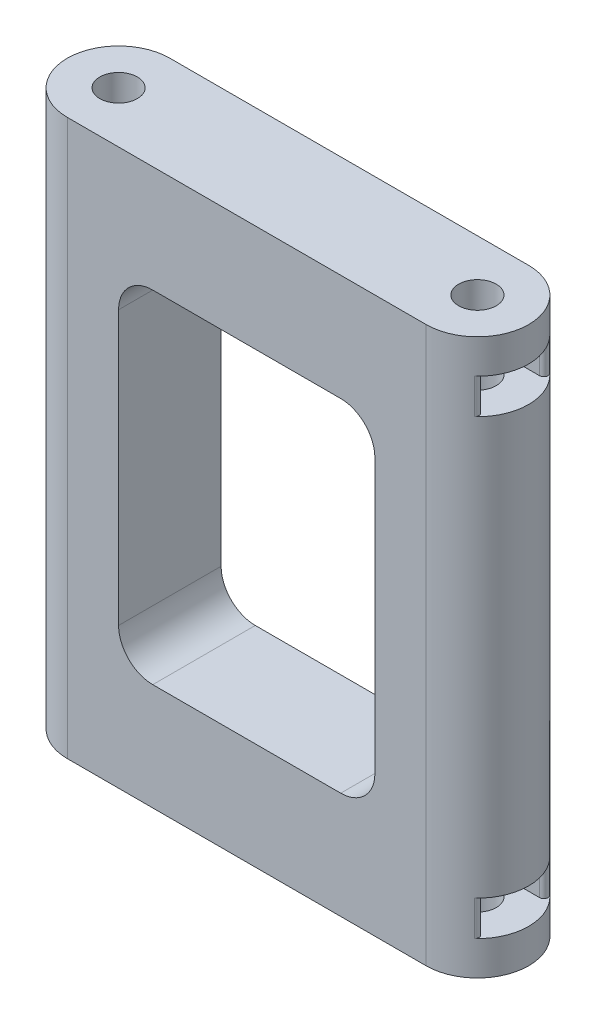
from build123d import *

# Parameters (mm, degrees)
SKETCH1_R            = 2.2
BOSS_EXTRUDE1_DEPTH  = 65
CUT_EXTRUDE1_DEPTH   = 4.1
FILLET1_R            = 0.5
FILLET1_OF_MIRROR1_R = 0.5
SKETCH4_W            = 30
SKETCH4_H            = 40
CUT_EXTRUDE2_DEPTH   = 82.688432474
FILLET2_R            = 4


with BuildPart() as part:
    # Sketch1 → Boss-Extrude1 (new body)
    with BuildSketch(Plane(origin=(0, 0, 0), x_dir=(1, 0, 0), z_dir=(0, 1, 0))):
        with BuildLine():
            Line((0, 6), (42, 6))
            ThreePointArc((42, 6), (48, 0), (42, -6))
            Line((42, -6), (0, -6))
            ThreePointArc((0, -6), (-6, 0), (0, 6))
        make_face()
        with Locations(Location((0, 0, 0), (0, 0, 270))):
            Circle(SKETCH1_R, mode=Mode.SUBTRACT)
        with Locations(Location((42, 0, 0), (0, 0, 270))):
            Circle(SKETCH1_R, mode=Mode.SUBTRACT)
    extrude(amount=BOSS_EXTRUDE1_DEPTH)

    # Sketch3 → Cut-Extrude1 (cut)
    with BuildSketch(Plane(origin=(0, 61, 0), x_dir=(1, 0, 0), z_dir=(0, 1, 0))):
        Polygon((4.099186911, 0), (2.049593456, 3.55), (-9.046065911, 3.55), (-8.518024666, -3.55), (2.049593456, -3.55), align=None)
        Polygon((39.950406544, 3.55), (51.046065911, 3.55), (50.518024666, -3.55), (39.950406544, -3.55), (37.900813089, 0), align=None)
    cut_extrude1 = extrude(amount=-CUT_EXTRUDE1_DEPTH, mode=Mode.SUBTRACT)

    # Fillet1
    fillet1_edges = [part.edges().sort_by_distance(p)[0] for p in [
        (46.837096236, 58.95, 3.55),
        (46.837096236, 58.95, -3.55),
        (-4.837096236, 58.95, -3.55),
        (-4.837096236, 58.95, 3.55),
    ]]
    fillet(fillet1_edges, radius=FILLET1_R)

    # Mirror1: Cut-Extrude1 across plane
    add(cut_extrude1.mirror(Plane.ZX.offset(32.5)), mode=Mode.SUBTRACT)

    # Fillet1 of Mirror1
    fillet1_of_mirror1_edges = [part.edges().sort_by_distance(p)[0] for p in [
        (46.837096236, 6.05, 3.55),
        (46.837096236, 6.05, -3.55),
        (-4.837096236, 6.05, -3.55),
        (-4.837096236, 6.05, 3.55),
    ]]
    fillet(fillet1_of_mirror1_edges, radius=FILLET1_OF_MIRROR1_R)

    # Sketch4 → Cut-Extrude2 (cut, through all)
    with BuildSketch(Plane(origin=(0, 0, -6), x_dir=(-1, 0, 0), z_dir=(0, 0, -1))):
        with Locations((-21, 32.5)):
            Rectangle(SKETCH4_W, SKETCH4_H)
    extrude(amount=-CUT_EXTRUDE2_DEPTH, mode=Mode.SUBTRACT)

    # Fillet2
    fillet2_edges = [part.edges().sort_by_distance(p)[0] for p in [
        (6, 52.5, 0),
        (6, 12.5, 0),
        (36, 12.5, 0),
        (36, 52.5, 0),
    ]]
    fillet(fillet2_edges, radius=FILLET2_R)


solid = part.part
